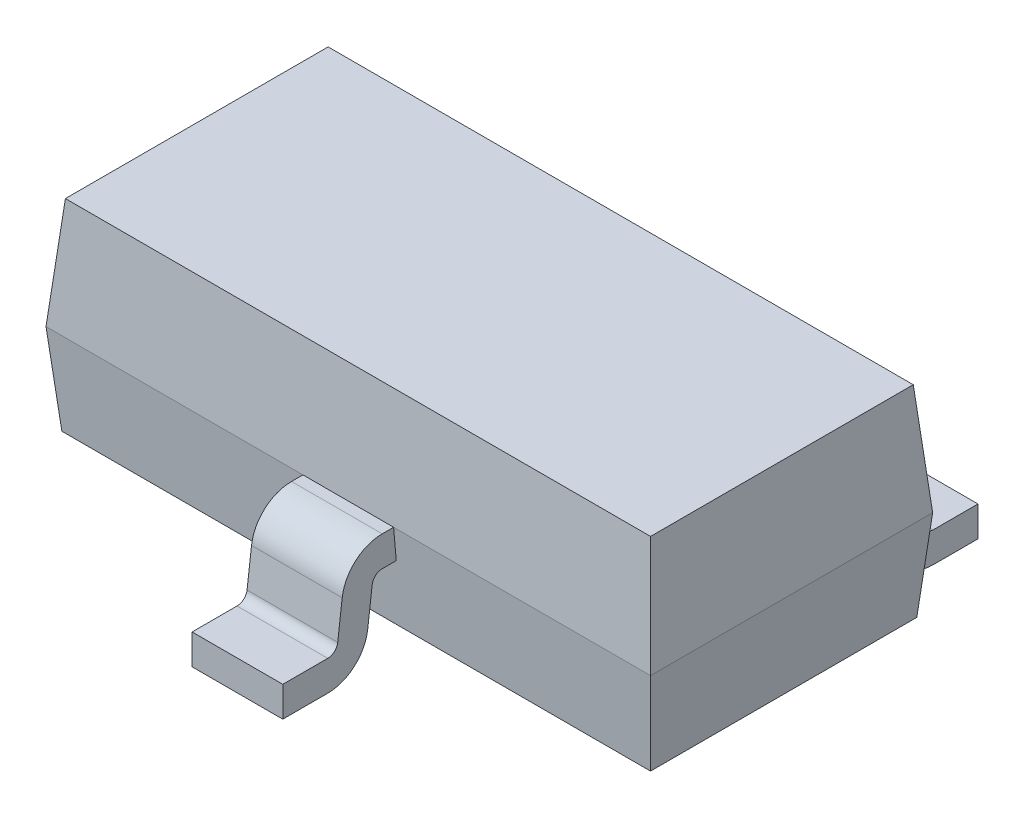
from build123d import *

# Parameters (mm, degrees)
SKETCH1_W                = 3
SKETCH1_H                = 1.4
EXTRUDE1_DEPTH           = 0.55
EXTRUDE1_TAPER           = 5
EXTRUDE1_OTHER_WAY_DEPTH = 0.45
EXTRUDE1_OTHER_WAY_TAPER = 5
EXTRUDE2_DEPTH           = 0.225
EXTRUDE2_DEPTH_BACK      = 0.225
EXTRUDE3_START           = 0.95
EXTRUDE3_DEPTH           = 0.225
FILLET1_R                = 0.05
FILLET2_R                = 0.2


with BuildPart() as part:
    # Sketch1 → Extrude1 (new body)
    with BuildSketch(Plane(origin=(0, 0, 0), x_dir=(1, 0, 0), z_dir=(0, 1, 0))):
        Rectangle(SKETCH1_W, SKETCH1_H)
    extrude(amount=EXTRUDE1_DEPTH, taper=EXTRUDE1_TAPER)

    # Sketch1 → Extrude1 other way (add)
    with BuildSketch(Plane(origin=(0, 0, 0), x_dir=(1, 0, 0), z_dir=(0, 1, 0))):
        Rectangle(SKETCH1_W, SKETCH1_H)
    extrude(amount=-EXTRUDE1_OTHER_WAY_DEPTH, taper=EXTRUDE1_OTHER_WAY_TAPER)

    # Sketch2 → Extrude2 (add, two sides: drawn at the far end of the back side and taken through both)
    with BuildSketch(Plane(origin=(0, 0, 0), x_dir=(0, 0, -1), z_dir=(1, 0, 0)).offset(-EXTRUDE2_DEPTH_BACK)):
        Polygon((-0.585273808, 0), (-0.933594965, 0), (-0.98270879, -0.4), (-1.25, -0.4), (-1.25, -0.55), (-0.85, -0.55), (-0.800886176, -0.15), (-0.585273808, -0.15), align=None)
    extrude(amount=EXTRUDE2_DEPTH + EXTRUDE2_DEPTH_BACK)

    # Sketch2<3> → Extrude3 (add, symmetric)
    with BuildSketch(Plane(origin=(0, 0, 0), x_dir=(0, 0, -1), z_dir=(1, 0, 0)).offset(EXTRUDE3_START)):
        Polygon((0.585273808, 0), (0.933594965, 0), (0.98270879, -0.4), (1.25, -0.4), (1.25, -0.55), (0.85, -0.55), (0.800886176, -0.15), (0.585273808, -0.15), align=None)
    extrude3 = extrude(amount=EXTRUDE3_DEPTH, both=True)

    # Mirror1: Extrude3 across plane
    add(extrude3.mirror(Plane(origin=(0, 0, 0), x_dir=(0, 0, 1), z_dir=(1, 0, 0))))

    # Fillet1
    fillet1_edges = [part.edges().sort_by_distance(p)[0] for p in [
        (0, -0.4, 0.98270879),
        (0, -0.15, 0.800886176),
        (0.95, -0.15, -0.800886176),
        (0.95, -0.4, -0.98270879),
        (-0.95, -0.4, -0.98270879),
        (-0.95, -0.15, -0.800886176),
    ]]
    fillet(fillet1_edges, radius=FILLET1_R)

    # Fillet2
    fillet2_edges = [part.edges().sort_by_distance(p)[0] for p in [
        (0, 0, 0.933594965),
        (0, -0.55, 0.85),
        (0.95, 0, -0.933594965),
        (0.95, -0.55, -0.85),
        (-0.95, 0, -0.933594965),
        (-0.95, -0.55, -0.85),
    ]]
    fillet(fillet2_edges, radius=FILLET2_R)


solid = part.part
